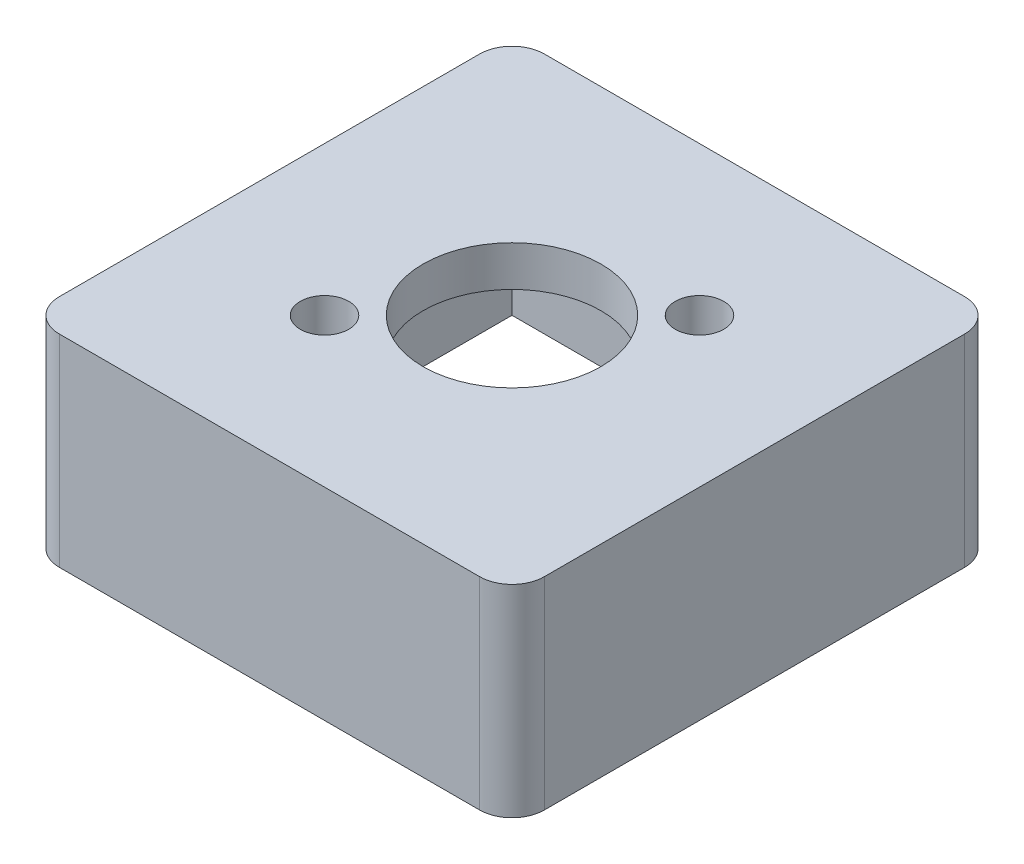
from build123d import *

# Parameters (mm, degrees)
SKETCH1_W           = 38.1
SKETCH1_H           = 38.1
SKETCH1_R           = 1.905
SKETCH1_R_2         = 6.985
BOSS_EXTRUDE1_DEPTH = 3.175
SKETCH1_3_W         = 38.1
SKETCH1_3_H         = 38.1
SKETCH1_3_W_2       = 31.75
SKETCH1_3_H_2       = 31.75
BOSS_EXTRUDE2_DEPTH = 12.7
FILLET1_R           = 2.54


with BuildPart() as part:
    # Sketch1 → Boss-Extrude1 (new body)
    with BuildSketch(Plane(origin=(0, 0, 0), x_dir=(1, 0, 0), z_dir=(0, 1, 0))):
        Rectangle(SKETCH1_W, SKETCH1_H)
        with Locations((7.363810019, 7.363810019)):
            Circle(SKETCH1_R, mode=Mode.SUBTRACT)
        with Locations((-7.363810019, -7.363810019)):
            Circle(SKETCH1_R, mode=Mode.SUBTRACT)
        Circle(SKETCH1_R_2, mode=Mode.SUBTRACT)
    extrude(amount=BOSS_EXTRUDE1_DEPTH)

    # Sketch1<3> → Boss-Extrude2 (add)
    with BuildSketch(Plane(origin=(0, 0, 0), x_dir=(1, 0, 0), z_dir=(0, 1, 0))):
        Rectangle(SKETCH1_3_W, SKETCH1_3_H)
        Rectangle(SKETCH1_3_W_2, SKETCH1_3_H_2, mode=Mode.SUBTRACT)
    extrude(amount=-BOSS_EXTRUDE2_DEPTH)

    # Fillet1
    fillet1_edges = [part.edges().sort_by_distance(p)[0] for p in [
        (-19.05, -4.7625, -19.05),
        (19.05, -4.7625, -19.05),
        (-19.05, -4.7625, 19.05),
        (19.05, -4.7625, 19.05),
    ]]
    fillet(fillet1_edges, radius=FILLET1_R)


solid = part.part
